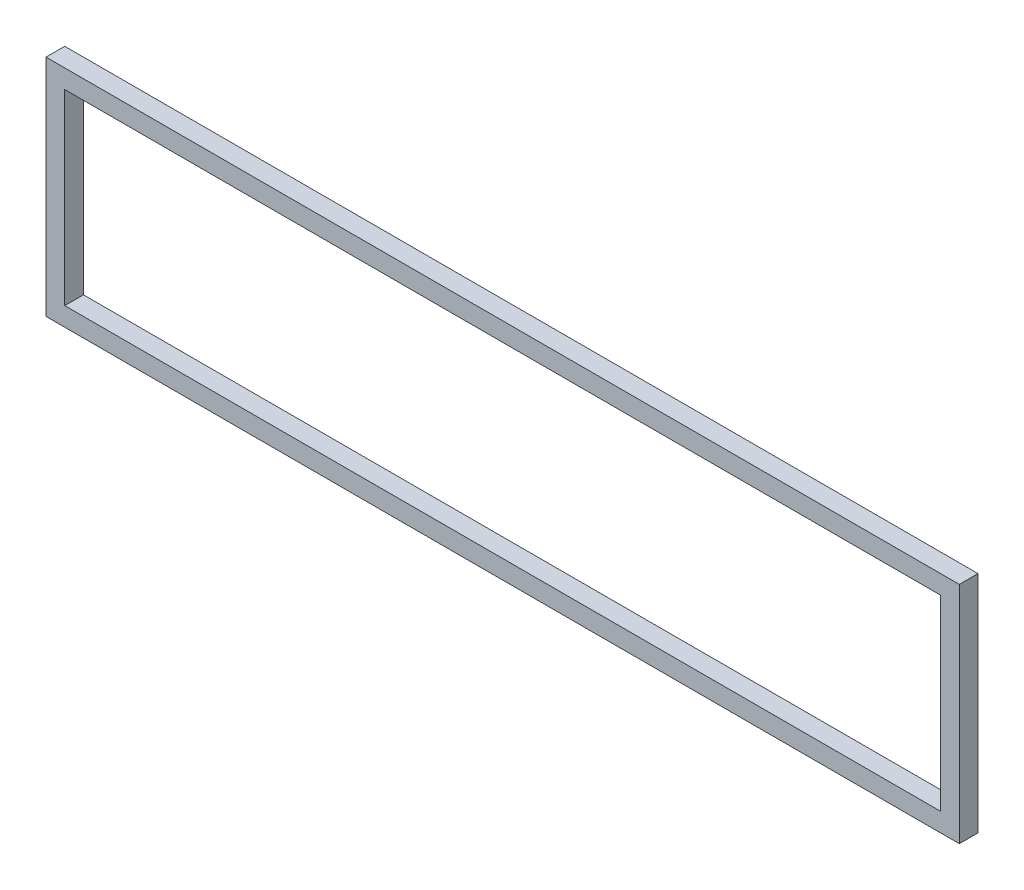
from build123d import *

# Parameters (mm, degrees)
SKETCH1_W           = 2440
SKETCH1_H           = 600
SKETCH1_W_2         = 2340
SKETCH1_H_2         = 500
BOSS_EXTRUDE1_DEPTH = 50


with BuildPart() as part:
    # Sketch1 → Boss-Extrude1 (new body)
    with BuildSketch(Plane.XY):
        with Locations((526.382978723, -55.319148936)):
            Rectangle(SKETCH1_W, SKETCH1_H)
        with Locations((526.382978723, -55.319148936)):
            Rectangle(SKETCH1_W_2, SKETCH1_H_2, mode=Mode.SUBTRACT)
    extrude(amount=BOSS_EXTRUDE1_DEPTH)


solid = part.part
